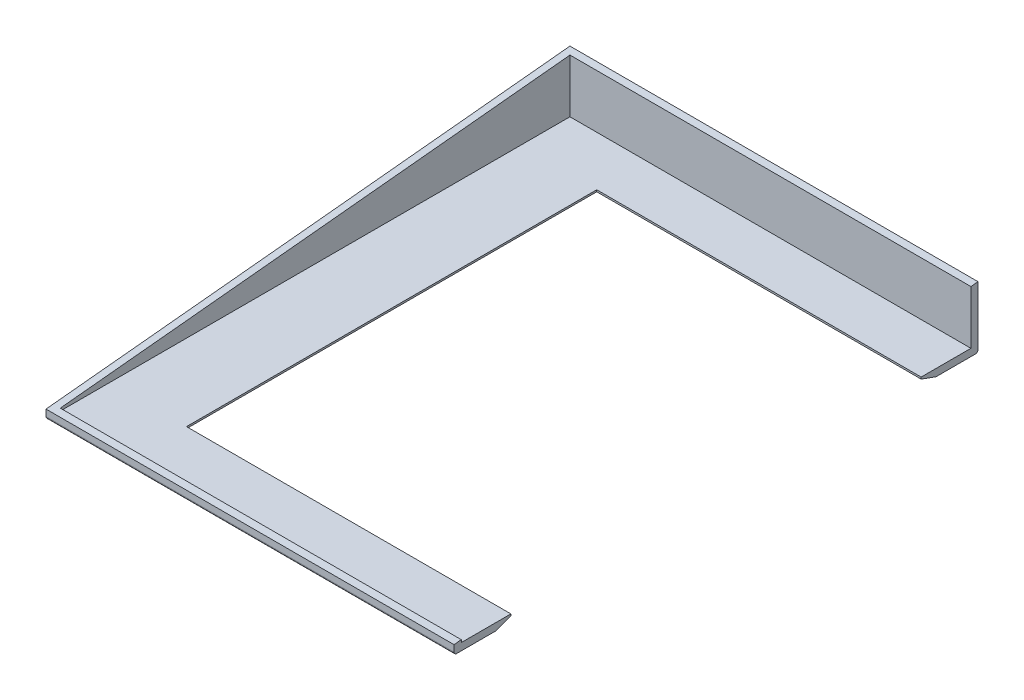
from build123d import *
from OCP.BRepFilletAPI import BRepFilletAPI_MakeChamfer

# Parameters (mm, degrees)
CROQUIS1_W                 = 220.407444928
CROQUIS1_H                 = 139.358729484
CROQUIS1_W_2               = 180
CROQUIS1_H_2               = 113.81
SALIENTE_EXTRUIR1_DEPTH    = 2
EXTRUIR_L_MINA3_DEPTH      = 16.5
EXTRUIR_L_MINA3_DEPTH_BACK = 2
CROQUIS2_W                 = 226.407444928
CROQUIS2_H                 = 145.358729484
CROQUIS2_W_2               = 220.407444928
CROQUIS2_H_2               = 139.358729484
CROQUIS6_W                 = 222.447038553
CROQUIS6_H                 = 141.398323109
CORTAR_EXTRUIR2_DEPTH      = 16.5
CORTAR_EXTRUIR3_REACH      = 240.505
CORTAR_EXTRUIR4_DEPTH      = 1.960406375
REDONDEO2_R                = 0.7
CHAFL_N1_SIZE              = 1.5
CHAFL_N1_SIZE2             = 4.121216129
REDONDEO3_R                = 0.7


with BuildPart() as part:
    # Croquis1 → Saliente-Extruir1 (new body)
    with BuildSketch(Plane(origin=(0, 0, 0), x_dir=(1, 0, 0), z_dir=(0, 1, 0))):
        Rectangle(CROQUIS1_W, CROQUIS1_H)
        Rectangle(CROQUIS1_W_2, CROQUIS1_H_2, mode=Mode.SUBTRACT)
    extrude(amount=SALIENTE_EXTRUIR1_DEPTH)

    # Croquis2 → Extruir-Lámina3 (add, two sides: drawn at the far end of the back side and taken through both)
    with BuildSketch(Plane(origin=(0, 2, 0), x_dir=(1, 0, 0), z_dir=(0, 1, 0)).offset(-EXTRUIR_L_MINA3_DEPTH_BACK)):
        Rectangle(CROQUIS2_W, CROQUIS2_H)
        Rectangle(CROQUIS2_W_2, CROQUIS2_H_2, mode=Mode.SUBTRACT)
    extrude(amount=EXTRUIR_L_MINA3_DEPTH + EXTRUIR_L_MINA3_DEPTH_BACK)

    # Croquis6 → Cortar-Extruir2 (cut)
    with BuildSketch(Plane(origin=(0, 18.5, 0), x_dir=(1, 0, 0), z_dir=(0, 1, 0))):
        with Locations((-0.019796812, 0.019796812)):
            Rectangle(CROQUIS6_W, CROQUIS6_H)
    extrude(amount=-CORTAR_EXTRUIR2_DEPTH, mode=Mode.SUBTRACT)

    # Cortar-Extruir3: up to this face of the body (flat: up to its plane)
    cortar_extruir3_end = Plane(part.part.faces().sort_by_distance((113.203722464, 9.25, 0))[0])
    # Croquis7 → Cortar-Extruir3 (cut, up to the picked face)
    with BuildSketch(Plane.ZY.offset(113.203722464), mode=Mode.PRIVATE) as cortar_extruir3_sk1:
        Polygon((-72.679364742, 18.5), (-72.679364742, 17.034353119), (72.679364742, 2.5), (72.679364742, 18.5), align=None)
    cortar_extruir3_tool1 = split(extrude(cortar_extruir3_sk1.sketch, amount=-CORTAR_EXTRUIR3_REACH, mode=Mode.PRIVATE), bisect_by=cortar_extruir3_end, keep=Keep.BOTH, mode=Mode.PRIVATE)
    add(cortar_extruir3_tool1.solids().sort_by(Axis((-113.203722, 13.12567, 20.160481), (1, 0, 0)))[0], mode=Mode.SUBTRACT)

    # Croquis8 → Cortar-Extruir4 (cut)
    with BuildSketch(Plane(origin=(0, 0, -72.679364742), x_dir=(-1, 0, 0), z_dir=(0, 0, -1))):
        with BuildLine():
            Line((-33.703722464, 17.034353119), (-74.703722464, 17.034353119))
            Line((-74.703722464, 17.034353119), (-74.703722464, 9.034353119))
            ThreePointArc((-74.703722464, 9.034353119), (-74.264382636, 7.973692947), (-73.203722464, 7.534353119))
            Line((-73.203722464, 7.534353119), (-35.203722464, 7.534353119))
            ThreePointArc((-35.203722464, 7.534353119), (-34.143062292, 7.973692947), (-33.703722464, 9.034353119))
            Line((-33.703722464, 9.034353119), (-33.703722464, 17.034353119))
        make_face()
    extrude(amount=-CORTAR_EXTRUIR4_DEPTH, mode=Mode.SUBTRACT)

    # Redondeo2
    redondeo2_edges = [part.edges().sort_by_distance(p)[0] for p in [
        (33.703722464, 12.936343049, -70.718958367),
        (34.143062292, 7.973692947, -70.718958367),
        (54.203722464, 7.534353119, -70.718958367),
        (74.264382636, 7.973692947, -70.718958367),
        (74.703722464, 12.936343049, -70.718958367),
        (74.703722464, 13.034353119, -72.679364742),
        (74.264382636, 7.973692947, -72.679364742),
        (54.203722464, 7.534353119, -72.679364742),
        (34.143062292, 7.973692947, -72.679364742),
        (33.703722464, 13.034353119, -72.679364742),
    ]]
    fillet(redondeo2_edges, radius=REDONDEO2_R)

    # Chaflán1: one chamfer whose edges measure the first distance from different faces: ONE call of the kernel's chamfer builder (chamfer() names one face for all edges)
    chafl_n1_edges_1 = [part.edges().sort_by_distance(p)[0] for p in [
        (90, 0, 0),
    ]]
    chafl_n1_side_1 = [part.faces().sort_by_distance(p)[0] for p in [
        (90, 1, 0),
    ]]
    chafl_n1_edges_2 = [part.edges().sort_by_distance(p)[0] for p in [
        (0, 0, -56.905),
    ]]
    chafl_n1_side_2 = [part.faces().sort_by_distance(p)[0] for p in [
        (0, 1, -56.905),
    ]]
    chafl_n1_edges_3 = [part.edges().sort_by_distance(p)[0] for p in [
        (-90, 0, 0),
    ]]
    chafl_n1_side_3 = [part.faces().sort_by_distance(p)[0] for p in [
        (-90, 1, 0),
    ]]
    chafl_n1_edges_4 = [part.edges().sort_by_distance(p)[0] for p in [
        (0, 0, 56.905),
    ]]
    chafl_n1_side_4 = [part.faces().sort_by_distance(p)[0] for p in [
        (0, 1, 56.905),
    ]]
    chafl_n1 = BRepFilletAPI_MakeChamfer(part.part.solid().wrapped)
    for e in chafl_n1_edges_1:
        chafl_n1.Add(CHAFL_N1_SIZE, CHAFL_N1_SIZE2, e.wrapped, chafl_n1_side_1[0].wrapped)  # the first distance lies on this face
    for e in chafl_n1_edges_2:
        chafl_n1.Add(CHAFL_N1_SIZE, CHAFL_N1_SIZE2, e.wrapped, chafl_n1_side_2[0].wrapped)  # the first distance lies on this face
    for e in chafl_n1_edges_3:
        chafl_n1.Add(CHAFL_N1_SIZE, CHAFL_N1_SIZE2, e.wrapped, chafl_n1_side_3[0].wrapped)  # the first distance lies on this face
    for e in chafl_n1_edges_4:
        chafl_n1.Add(CHAFL_N1_SIZE, CHAFL_N1_SIZE2, e.wrapped, chafl_n1_side_4[0].wrapped)  # the first distance lies on this face
    add(Compound.cast(chafl_n1.Shape()), mode=Mode.REPLACE)

    # Redondeo3
    redondeo3_edges = [part.edges().sort_by_distance(p)[0] for p in [
        (-113.203722464, 0, 0),
        (0, 0, -72.679364742),
        (113.203722464, 0, 0),
        (0, 0, 72.679364742),
    ]]
    fillet(redondeo3_edges, radius=REDONDEO3_R)

    # Partir1
    split(bisect_by=Plane(origin=(0, 0, 0), x_dir=(0, 0, 1), z_dir=(1, 0, 0)), keep=Keep.BOTTOM)


solid = part.part
